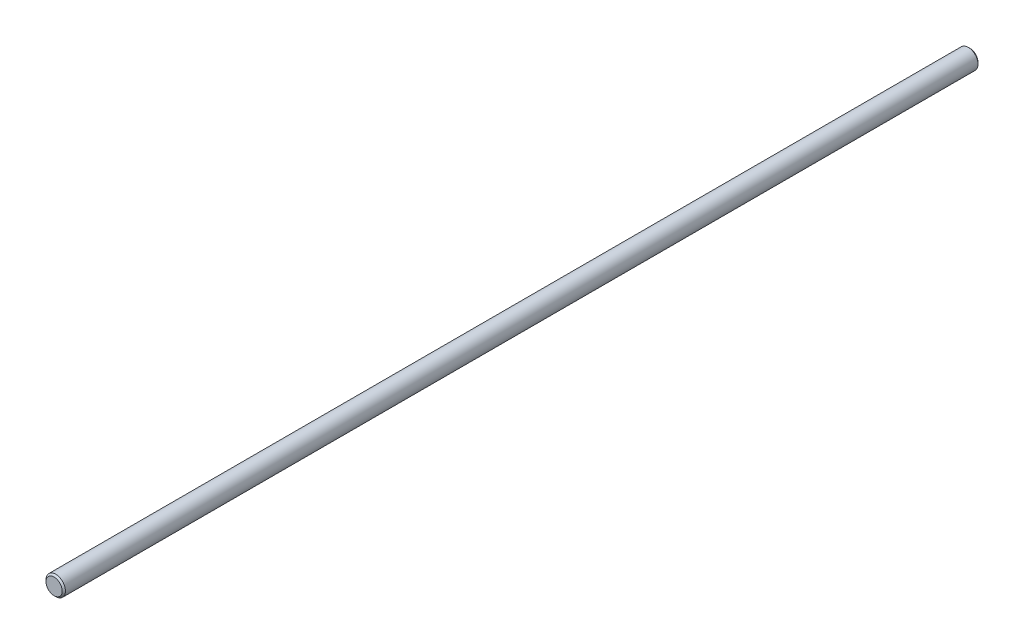
from build123d import *

# Parameters (mm, degrees)
SKETCH1_R           = 3
BOSS_EXTRUDE1_DEPTH = 141.25
CHAMFER1_SIZE       = 0.5


with BuildPart() as part:
    # Sketch1 → Boss-Extrude1 (new, symmetric)
    with BuildSketch(Plane.XY):
        Circle(SKETCH1_R)
    extrude(amount=BOSS_EXTRUDE1_DEPTH, both=True)

    # Chamfer1
    chamfer1_edges = [part.edges().sort_by_distance(p)[0] for p in [
        (-3, 0, -141.25),
        (-3, 0, 141.25),
    ]]
    chamfer(chamfer1_edges, length=CHAMFER1_SIZE)


solid = part.part
